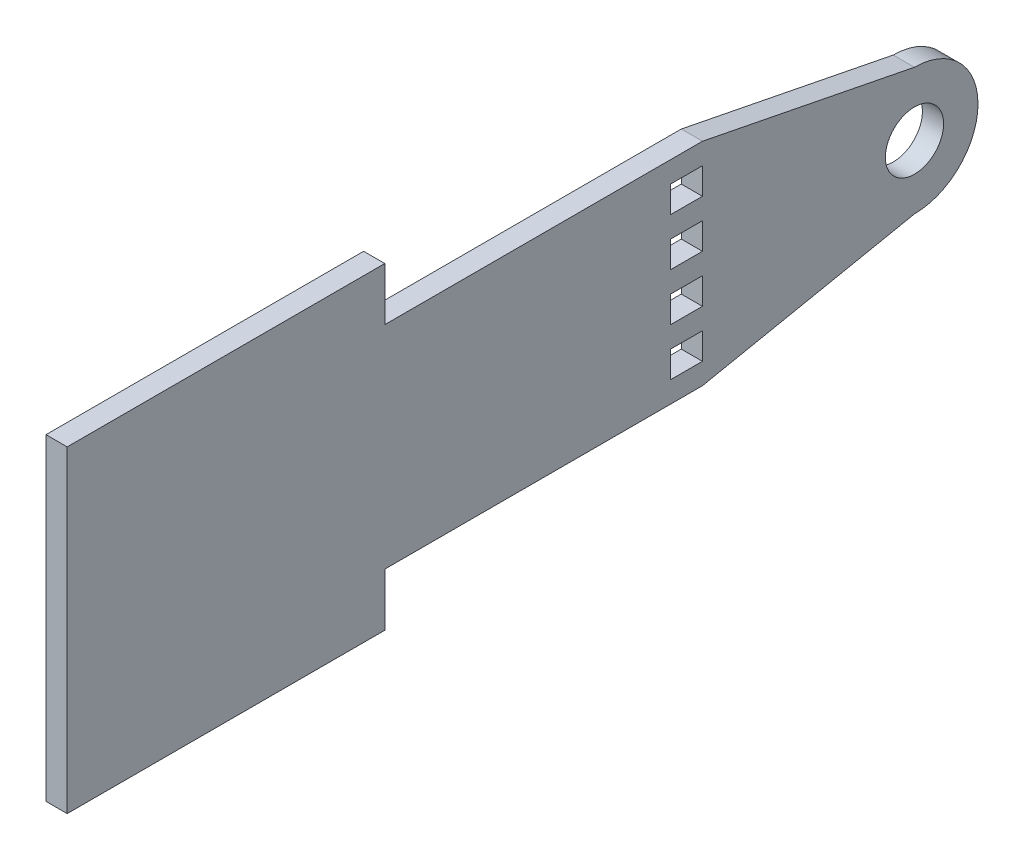
from build123d import *

# Parameters (mm, degrees)
SKETCH1_R           = 2.75
SKETCH1_W           = 3
SKETCH1_H           = 2.5
BOSS_EXTRUDE1_DEPTH = 2


with BuildPart() as part:
    # Sketch1 → Boss-Extrude1 (new body)
    with BuildSketch(Plane(origin=(0, 0, 0), x_dir=(0, 0, -1), z_dir=(1, 0, 0))):
        with BuildLine():
            Line((30, 10), (0, 10))
            Line((0, 10), (0, 15))
            Line((0, 15), (-30, 15))
            Line((-30, 15), (-30, -15))
            Line((-30, -15), (0, -15))
            Line((0, -15), (0, -10))
            Line((0, -10), (30, -10))
            Line((30, -10), (50.02830583, -5.958427618))
            ThreePointArc((50.02830583, -5.958427618), (56.02830583, 0.041572382), (50.02830583, 6.041572382))
            Line((50.02830583, 6.041572382), (30, 10))
        make_face()
        with Locations((50.02830583, 0.041572382)):
            Circle(SKETCH1_R, mode=Mode.SUBTRACT)
        with Locations((28.5, -6.75)):
            Rectangle(SKETCH1_W, SKETCH1_H, mode=Mode.SUBTRACT)
        with Locations((28.5, -2.25)):
            Rectangle(SKETCH1_W, SKETCH1_H, mode=Mode.SUBTRACT)
        with Locations((28.5, 2.25)):
            Rectangle(SKETCH1_W, SKETCH1_H, mode=Mode.SUBTRACT)
        with Locations((28.5, 6.75)):
            Rectangle(SKETCH1_W, SKETCH1_H, mode=Mode.SUBTRACT)
    extrude(amount=BOSS_EXTRUDE1_DEPTH)


solid = part.part
